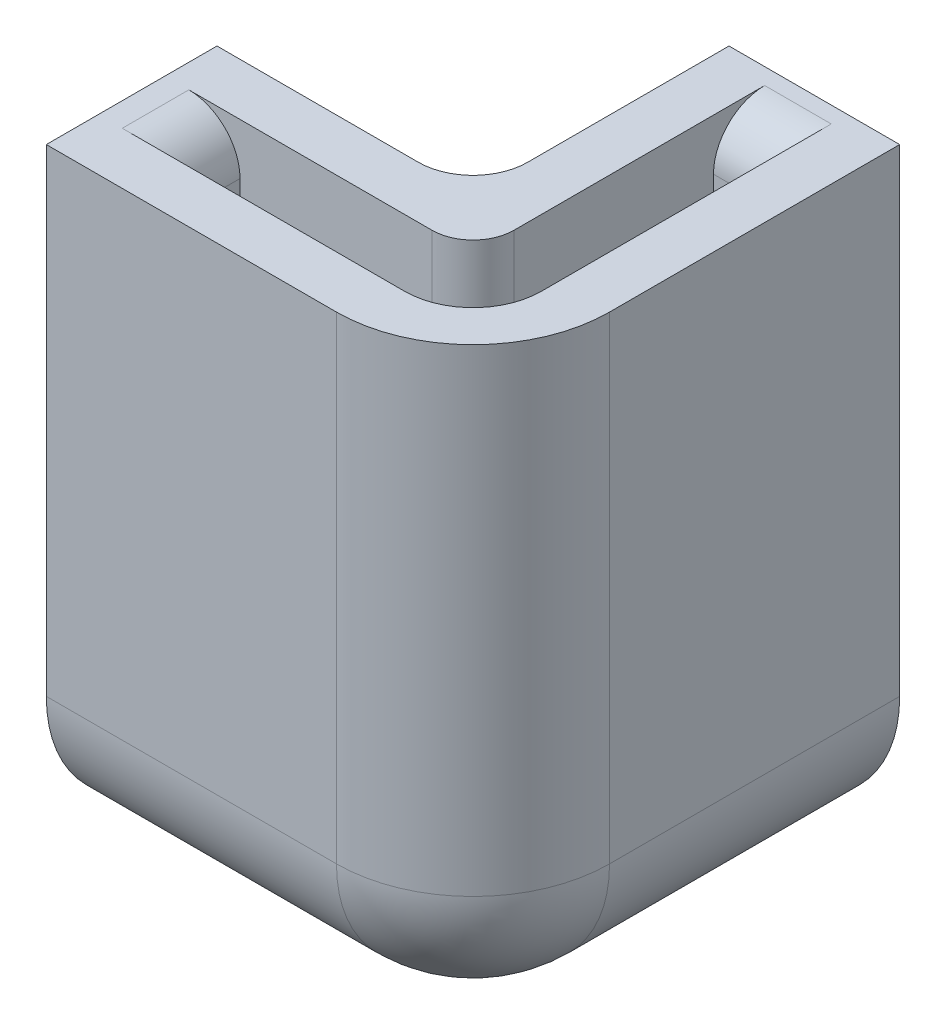
from build123d import *
from OCP.BRepFilletAPI import BRepFilletAPI_MakeFillet

# Parameters (mm, degrees)
BOSS_EXTRUDE1_DEPTH = 18
SKETCH3_W           = 7.5
SKETCH3_H           = 7.5
BOSS_EXTRUDE2_DEPTH = 5
CUT_EXTRUDE1_DEPTH  = 8
FILLET1_R1          = 4
FILLET1_R2          = 1.6
FILLET1_R3          = 1.5


with BuildPart() as part:
    # Sketch1 → Boss-Extrude1 (new body)
    with BuildSketch(Plane(origin=(0, 0, 0), x_dir=(1, 0, 0), z_dir=(0, 1, 0))):
        Polygon((0, 0), (12.5, 0), (12.5, 12.5), (7.5, 12.5), (7.5, 5), (0, 5), align=None)
    extrude(amount=BOSS_EXTRUDE1_DEPTH)

    # Sketch3 → Boss-Extrude2 (add)
    with BuildSketch(Plane.XZ):
        with Locations((3.75, -8.75)):
            Rectangle(SKETCH3_W, SKETCH3_H)
    extrude(amount=-BOSS_EXTRUDE2_DEPTH)

    # Sketch2 → Cut-Extrude1 (cut)
    with BuildSketch(Plane(origin=(0, 18, 0), x_dir=(1, 0, 0), z_dir=(0, 1, 0))):
        with BuildLine():
            Line((9.025, 10.52), (9.025, 4.675))
            ThreePointArc((9.025, 4.675), (8.673528137, 3.826471863), (7.825, 3.475))
            Line((7.825, 3.475), (2.2, 3.475))
            Line((2.2, 3.475), (2.2, 1.525))
            Line((2.2, 1.525), (8.975, 1.525))
            ThreePointArc((8.975, 1.525), (10.389213562, 2.110786438), (10.975, 3.525))
            Line((10.975, 3.525), (10.975, 10.52))
            Line((10.975, 10.52), (9.025, 10.52))
        make_face()
    extrude(amount=-CUT_EXTRUDE1_DEPTH, mode=Mode.SUBTRACT)

    # Fillet1: one fillet with a radius per group of edges: ONE call of the kernel's fillet builder (fillet() takes one radius for all edges)
    fillet1_edges_1 = [part.edges().sort_by_distance(p)[0] for p in [
        (12.5, 9, 0),
        (6.25, 0, 0),
        (12.5, 0, -6.25),
    ]]
    fillet1_edges_2 = [part.edges().sort_by_distance(p)[0] for p in [
        (7.5, 11.5, -5),
        (7.5, 5, -8.75),
        (3.75, 5, -5),
    ]]
    fillet1_edges_3 = [part.edges().sort_by_distance(p)[0] for p in [
        (2.2, 18, -2.5),
        (10, 18, -10.52),
    ]]
    fillet1 = BRepFilletAPI_MakeFillet(part.part.solid().wrapped)
    for e in fillet1_edges_1:
        fillet1.Add(FILLET1_R1, e.wrapped)
    for e in fillet1_edges_2:
        fillet1.Add(FILLET1_R2, e.wrapped)
    for e in fillet1_edges_3:
        fillet1.Add(FILLET1_R3, e.wrapped)
    add(Compound.cast(fillet1.Shape()), mode=Mode.REPLACE)


solid = part.part
